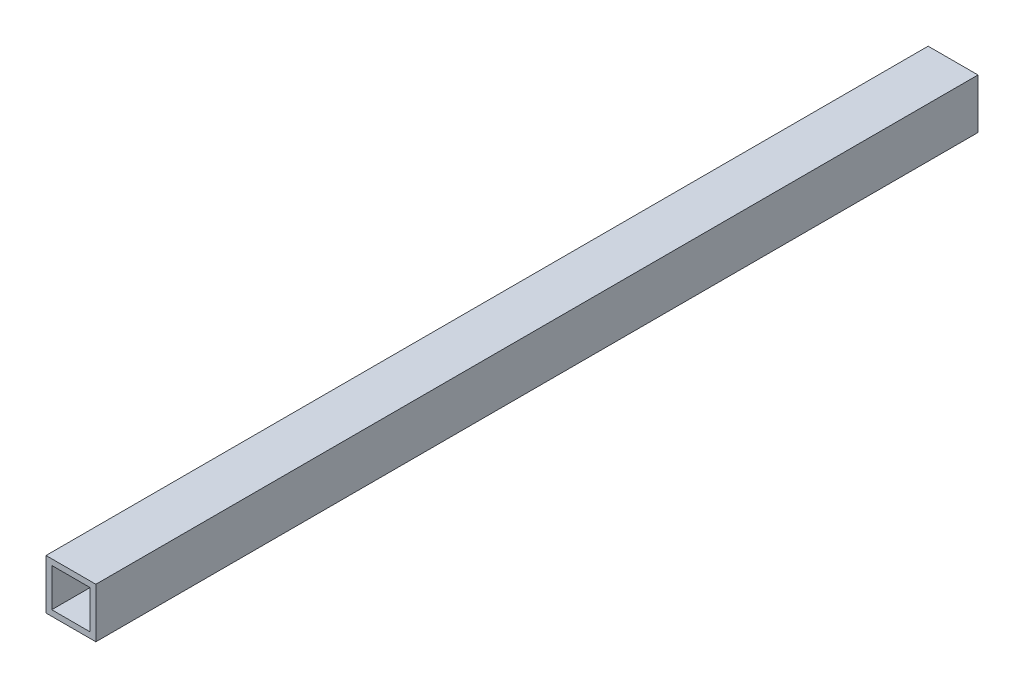
from build123d import *

# Parameters (mm, degrees)
SKETCH1_W           = 13
SKETCH1_H           = 13
SKETCH1_W_2         = 10
SKETCH1_H_2         = 10
BOSS_EXTRUDE1_DEPTH = 230


with BuildPart() as part:
    # Sketch1 → Boss-Extrude1 (new body)
    with BuildSketch(Plane.XY):
        Rectangle(SKETCH1_W, SKETCH1_H)
        Rectangle(SKETCH1_W_2, SKETCH1_H_2, mode=Mode.SUBTRACT)
    extrude(amount=BOSS_EXTRUDE1_DEPTH)


solid = part.part
